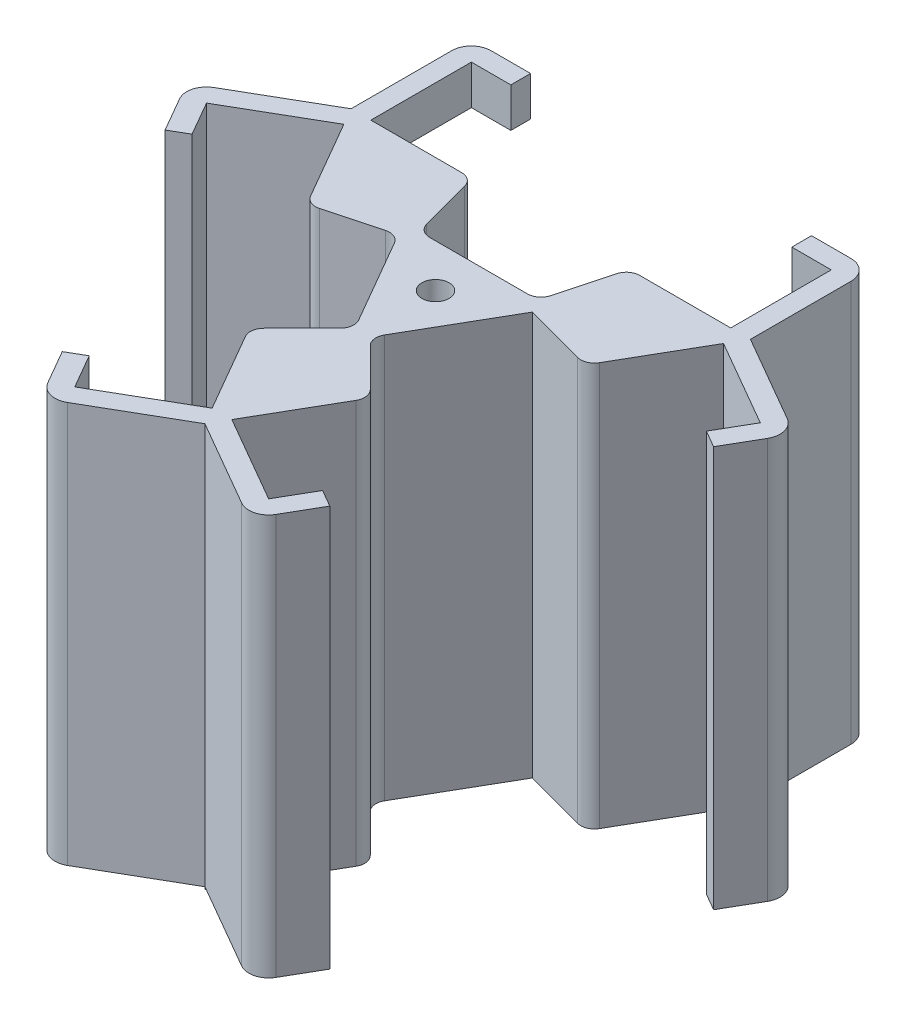
from build123d import *

# Parameters (mm, degrees)
SALIENTE_EXTRUIR1_DEPTH = 88.9
CROQUIS4_R              = 2.999994
CORTAR_EXTRUIR1_DEPTH   = 112.44204772
REDONDEO6_R             = 3
REDONDEO7_R             = 3
ESCALA2_SCALE           = 1.15
SALIENTE_EXTRUIR3_DEPTH = 101.6
CROQUIS10_W             = 32
CROQUIS10_H             = 81.6
CORTAR_EXTRUIR2_DEPTH   = 15


with BuildPart() as part:
    # Croquis1 → Saliente-Extruir1 (new body)
    with BuildSketch(Plane(origin=(0, 0, 0), x_dir=(1, 0, 0), z_dir=(0, 1, 0))):
        Polygon((1.696358741, -16.064461222), (13.335, -27.703102481), (0, -50.8), (-13.335, -27.703102481), (-1.696358741, -16.064461222), (-14.760410887, 6.563140847), (-30.659090512, 2.303102481), (-43.994090512, 25.4), (-17.324090512, 25.4), (-13.064052146, 9.501320374), (13.064052146, 9.501320374), (17.324090512, 25.4), (43.994090512, 25.4), (30.659090512, 2.303102481), (14.760410887, 6.563140847), align=None)
    extrude(amount=SALIENTE_EXTRUIR1_DEPTH)

    # Croquis4 → Cortar-Extruir1 (cut, through all)
    with BuildSketch(Plane(origin=(0, 88.9, 0), x_dir=(1, 0, 0), z_dir=(0, 1, 0))):
        with Locations(Location((0, 0, 0), (0, 0, 270))):
            Circle(CROQUIS4_R)
    extrude(amount=-CORTAR_EXTRUIR1_DEPTH, mode=Mode.SUBTRACT)

    # Redondeo6
    redondeo6_edges = [part.edges().sort_by_distance(p)[0] for p in [
        (-1.696358741, 44.45, 16.064461222),
        (-14.760410887, 44.45, -6.563140847),
        (-13.064052146, 44.45, -9.501320374),
        (13.064052146, 44.45, -9.501320374),
        (1.696358741, 44.45, 16.064461222),
    ]]
    fillet(redondeo6_edges, radius=REDONDEO6_R)

    # Redondeo7
    redondeo7_edges = [part.edges().sort_by_distance(p)[0] for p in [
        (-13.335, 44.45, 27.703102481),
        (-30.659090512, 44.45, -2.303102481),
        (-17.324090512, 44.45, -25.4),
        (17.324090512, 44.45, -25.4),
        (30.659090512, 44.45, -2.303102481),
        (13.335, 44.45, 27.703102481),
    ]]
    fillet(redondeo7_edges, radius=REDONDEO7_R)


with BuildPart() as part_1:
    # Escala2: scaled about (-0.008124988, 44.45, 0.003254237)
    add(part.part.scale(ESCALA2_SCALE).moved(Location((0.001218748, -6.6675, -0.000488136))))

    # Croquis8 → Saliente-Extruir3 (add)
    with BuildSketch(Plane(origin=(0, 95.5675, 0), x_dir=(1, 0, 0), z_dir=(0, 1, 0))):
        with BuildLine():
            Line((-50.591985341, 54.687778623), (-50.591985341, 29.210488136))
            Line((-50.591985341, 29.210488136), (-45.591985341, 29.210488136))
            Line((-45.591985341, 29.210488136), (-45.591985341, 54.687778623))
            Line((-45.591985341, 54.687778623), (-35.591985341, 54.687778623))
            Line((-35.591985341, 54.687778623), (-35.591985341, 59.687778623))
            Line((-35.591985341, 59.687778623), (-45.591985341, 59.687778623))
            ThreePointArc((-45.591985341, 59.687778623), (-49.127519247, 58.223312529), (-50.591985341, 54.687778623))
        make_face()
        with BuildLine():
            Line((-48.092688033, 24.881578215), (-50.591985341, 29.210488136))
            Line((-50.591985341, 29.210488136), (-50.592688033, 29.211705234))
            Line((-50.592688033, 29.211705234), (-72.656668815, 16.47305999))
            ThreePointArc((-72.656668815, 16.47305999), (-74.228672243, 15.044447763), (-75.065739696, 13.092155328))
            ThreePointArc((-75.065739696, 13.092155328), (-75.082537721, 12.995468496), (-75.099211211, 12.89876011))
            ThreePointArc((-75.099211211, 12.89876011), (-75.070496458, 11.218650606), (-74.486795834, 9.642932971))
            Line((-74.486795834, 9.642932971), (-69.486795834, 0.982678934))
            Line((-69.486795834, 0.982678934), (-65.156668815, 3.482678934))
            Line((-65.156668815, 3.482678934), (-70.156668815, 12.142932971))
            Line((-70.156668815, 12.142932971), (-48.092688033, 24.881578215))
        make_face()
        with BuildLine():
            Line((72.656998235, 16.471842892), (50.593017453, 29.210488136))
            Line((50.593017453, 29.210488136), (48.093017453, 24.880361117))
            Line((48.093017453, 24.880361117), (70.156998235, 12.141715873))
            Line((70.156998235, 12.141715873), (65.156998235, 3.481461835))
            Line((65.156998235, 3.481461835), (69.487125254, 0.981461835))
            Line((69.487125254, 0.981461835), (74.487125254, 9.641715873))
            ThreePointArc((74.487125254, 9.641715873), (74.986627366, 13.435811098), (72.656998235, 16.471842892))
        make_face()
        with BuildLine():
            ThreePointArc((50.594422837, 54.687778623), (49.129956743, 58.223312529), (45.594422837, 59.687778623))
            Line((45.594422837, 59.687778623), (35.594422837, 59.687778623))
            Line((35.594422837, 59.687778623), (35.594422837, 54.687778623))
            Line((35.594422837, 54.687778623), (45.594422837, 54.687778623))
            Line((45.594422837, 54.687778623), (45.594422837, 29.210488136))
            Line((45.594422837, 29.210488136), (50.593017453, 29.210488136))
            Line((50.593017453, 29.210488136), (50.594422837, 29.210488136))
            Line((50.594422837, 29.210488136), (50.594422837, 54.687778623))
        make_face()
        with BuildLine():
            Line((2.499813364, -54.089384846), (0.000516056, -58.418294766))
            Line((0.000516056, -58.418294766), (-0.000186636, -58.419511864))
            Line((-0.000186636, -58.419511864), (22.063794146, -71.158157108))
            ThreePointArc((22.063794146, -71.158157108), (25.857889371, -71.657659221), (28.893921165, -69.328030089))
            Line((28.893921165, -69.328030089), (33.893921165, -60.667776052))
            Line((33.893921165, -60.667776052), (29.563794146, -58.167776052))
            Line((29.563794146, -58.167776052), (24.563794146, -66.828030089))
            Line((24.563794146, -66.828030089), (2.499813364, -54.089384846))
        make_face()
        with BuildLine():
            Line((-22.063464726, -71.15694001), (0.000516056, -58.418294766))
            Line((0.000516056, -58.418294766), (-2.499483944, -54.088167747))
            Line((-2.499483944, -54.088167747), (-24.563464726, -66.826812991))
            Line((-24.563464726, -66.826812991), (-29.563464726, -58.166558953))
            Line((-29.563464726, -58.166558953), (-33.893591745, -60.666558953))
            Line((-33.893591745, -60.666558953), (-28.893591745, -69.326812991))
            ThreePointArc((-28.893591745, -69.326812991), (-25.857559952, -71.656442122), (-22.063464726, -71.15694001))
        make_face()
    extrude(amount=-SALIENTE_EXTRUIR3_DEPTH)

    # Croquis10 → Cortar-Extruir2 (cut)
    with BuildSketch(Plane.ZY.offset(50.591985341)):
        with Locations((-45.210488136, 44.7675)):
            Rectangle(CROQUIS10_W, CROQUIS10_H)
    extrude(amount=-CORTAR_EXTRUIR2_DEPTH, mode=Mode.SUBTRACT)


solid = part_1.part
